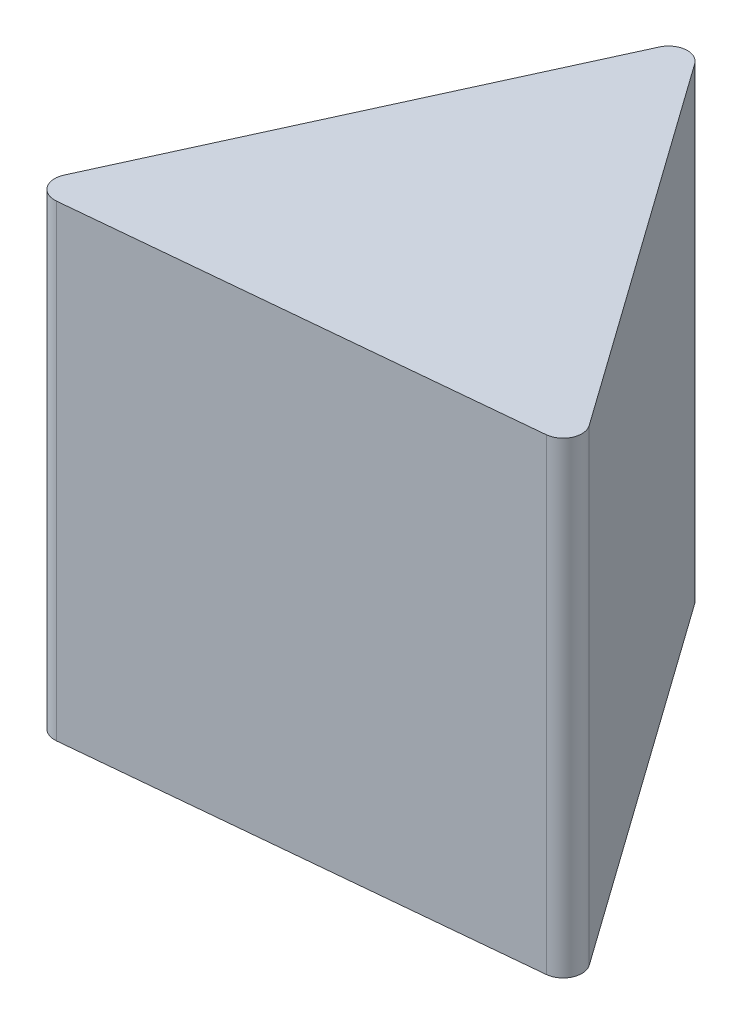
from build123d import *

# Parameters (mm, degrees)
BOSS_EXTRUDE1_DEPTH = 63.5
FILLET1_R           = 2.54


with BuildPart() as part:
    # Sketch1 → Boss-Extrude1 (new body)
    with BuildSketch(Plane(origin=(0, 0, 0), x_dir=(1, 0, 0), z_dir=(0, 1, 0))):
        Polygon((36.661742094, -16.753901694), (-3.821566567, 40.126950847), (-32.840175526, -23.373049153), align=None)
    extrude(amount=BOSS_EXTRUDE1_DEPTH)

    # Fillet1
    fillet1_edges = [part.edges().sort_by_distance(p)[0] for p in [
        (-32.840175526, 31.75, 23.373049153),
        (-3.821566567, 31.75, -40.126950847),
        (36.661742094, 31.75, 16.753901694),
    ]]
    fillet(fillet1_edges, radius=FILLET1_R)


solid = part.part
